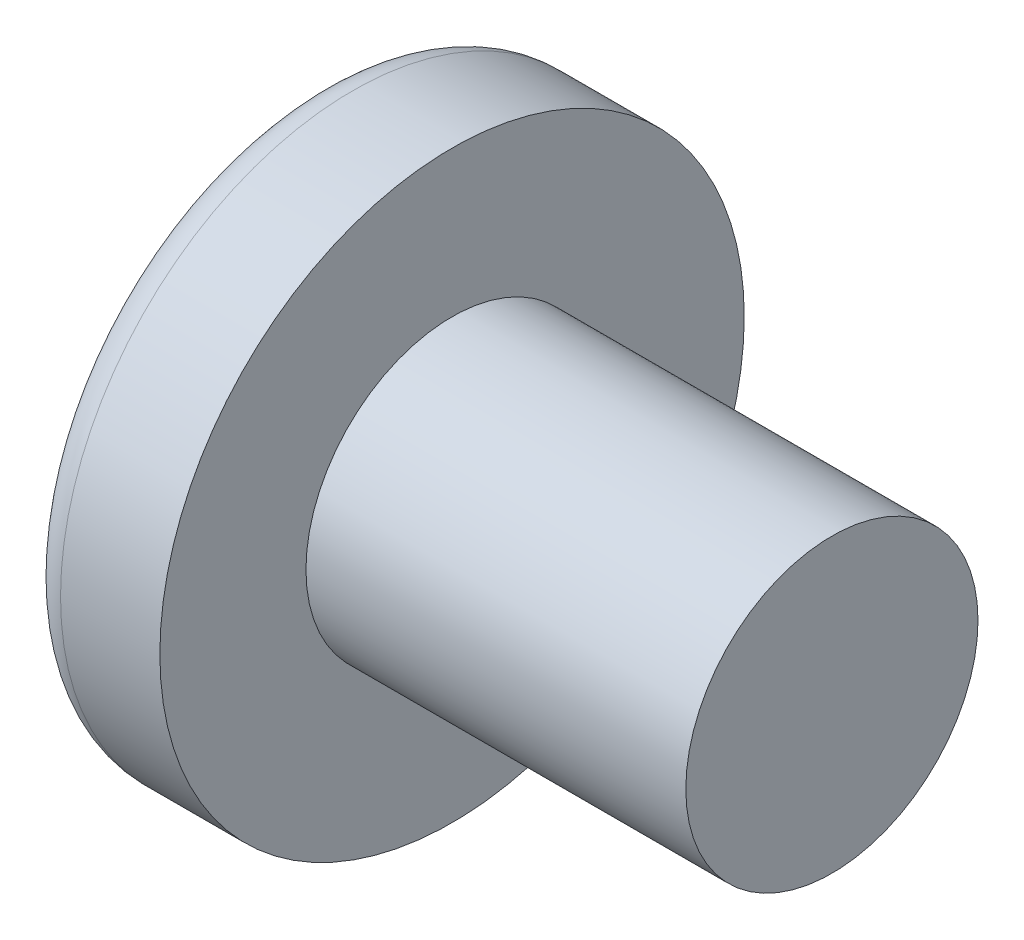
from build123d import *

# Parameters (mm, degrees)
CIRPATTERN1_COUNT = 2
CIRPATTERN1_ANGLE = 90


with BuildPart() as part:
    # BodySke → Base-Revolve (revolve)
    with BuildSketch(Plane.XY, mode=Mode.PRIVATE) as base_revolve_sk:
        with BuildLine():
            Line((7.5, 5), (7.5, 10))
            Line((7.5, 10), (4.100420175, 10))
            ThreePointArc((4.100420175, 10), (3.560149973, 9.871498067), (3.135589379, 9.513513514))
            ThreePointArc((3.135589379, 9.513513514), (0.804103022, 5.008464339), (0, 0))
            Line((0, 0), (20.5, 0))
            Line((20.5, 0), (20.5, 5))
            Line((20.5, 5), (7.5, 5))
        make_face()
    revolve(base_revolve_sk.sketch.rotate(Axis((-25.4, 0, 0), (1, 0, 0)), 90), axis=Axis((-25.4, 0, 0), (1, 0, 0)))

    # Sketch3 → Cut-Loft1 section 0
    with BuildSketch(Plane(origin=(0, 0, 0), x_dir=(0, 0, -1), z_dir=(1, 0, 0))):
        with BuildLine():
            Line((0.92, -5.09), (-0.92, -5.09))
            Line((-0.92, -5.09), (-0.92, 5.09))
            Line((-0.92, 5.09), (0.92, 5.09))
            Line((0.92, 5.09), (0.92, -5.09))
        make_face()
    # Sketch4 → Cut-Loft1 section 1
    with BuildSketch(Plane(origin=(6.09, 0, 0), x_dir=(0, 0, -1), z_dir=(1, 0, 0))):
        with BuildLine():
            Line((0.46, -0.46), (-0.46, -0.46))
            Line((-0.46, -0.46), (-0.46, 0.46))
            Line((-0.46, 0.46), (0.46, 0.46))
            Line((0.46, 0.46), (0.46, -0.46))
        make_face()
    cut_loft1 = loft(mode=Mode.SUBTRACT)

    # CirPattern1: Cut-Loft1 ×2 about axis
    cirpattern1_axis = Axis((0, 0, 0), (1, 0, 0))
    for i in range(1, CIRPATTERN1_COUNT):
        add(cut_loft1.rotate(cirpattern1_axis, i * CIRPATTERN1_ANGLE / (CIRPATTERN1_COUNT - 1)), mode=Mode.SUBTRACT)


solid = part.part
